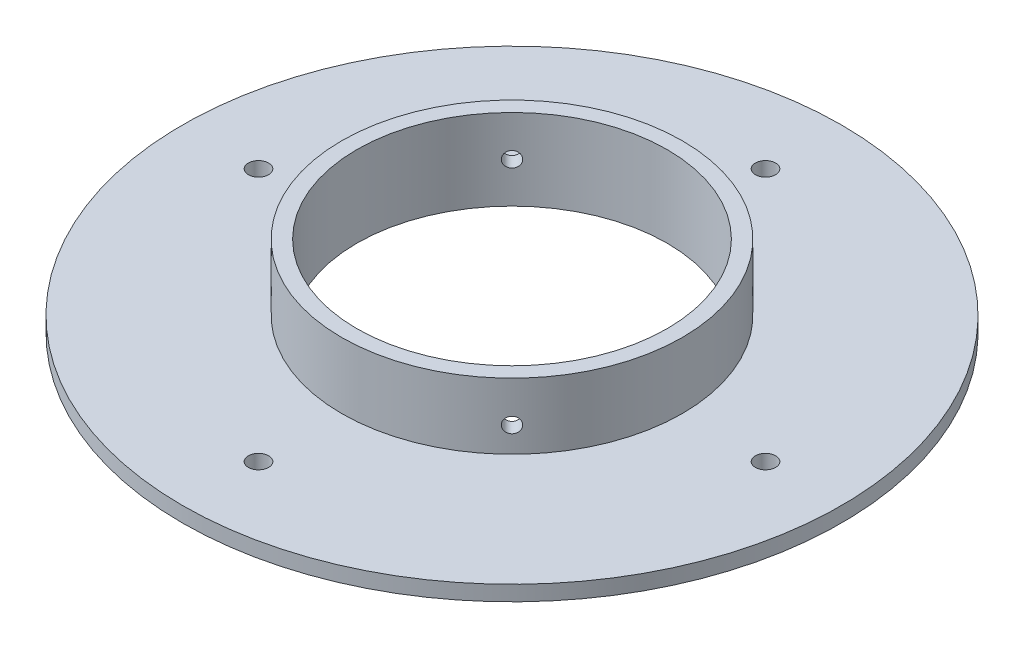
from build123d import *

# Parameters (mm, degrees)
SKETCH3_R          = 2
CUT_EXTRUDE1_DEPTH = 93.838569571
SKETCH5_R          = 1.5
CUT_EXTRUDE2_DEPTH = 94.305948363
CIRPATTERN1_COUNT  = 4


with BuildPart() as part:
    # Sketch2 → Revolve1 (revolve)
    with BuildSketch(Plane.XY, mode=Mode.PRIVATE) as revolve1_sk:
        Polygon((30.6, 16), (30.6, 0), (65, 0), (65, 3), (33.6, 3), (33.6, 16), align=None)
    revolve(revolve1_sk.sketch.rotate(Axis((0, 31.868523677, 0), (0, -1, 0)), 90), axis=Axis((0, 31.868523677, 0), (0, -1, 0)))

    # Sketch3 → Cut-Extrude1 (cut, through all)
    with BuildSketch(Plane(origin=(0, 3, 0), x_dir=(1, 0, 0), z_dir=(0, 1, 0))):
        with Locations(Location((0, 50, 0), (0, 0, 270))):
            Circle(SKETCH3_R)
        with Locations(Location((50, 0, 0), (0, 0, 270))):
            Circle(SKETCH3_R)
        with Locations(Location((0, -50, 0), (0, 0, 270))):
            Circle(SKETCH3_R)
        with Locations(Location((-50, 0, 0), (0, 0, 270))):
            Circle(SKETCH3_R)
    extrude(amount=-CUT_EXTRUDE1_DEPTH, mode=Mode.SUBTRACT)

    # Sketch5 → Cut-Extrude2 (cut, through all)
    with BuildSketch(Plane(origin=(0, 0, 0), x_dir=(0, 1, 0), z_dir=(0.7071067811865488, 0, 0.7071067811865464))):
        with Locations(Location((8, 0, 0), (0, 0, 270))):
            Circle(SKETCH5_R)
    cut_extrude2 = extrude(amount=-CUT_EXTRUDE2_DEPTH, mode=Mode.SUBTRACT)

    # CirPattern1: Cut-Extrude2 ×4 about axis
    cirpattern1_axis = Axis((0, 31.868523677, 0), (0, 1, 0))
    for i in range(1, CIRPATTERN1_COUNT):
        add(cut_extrude2.rotate(cirpattern1_axis, i * 360 / CIRPATTERN1_COUNT), mode=Mode.SUBTRACT)


solid = part.part
